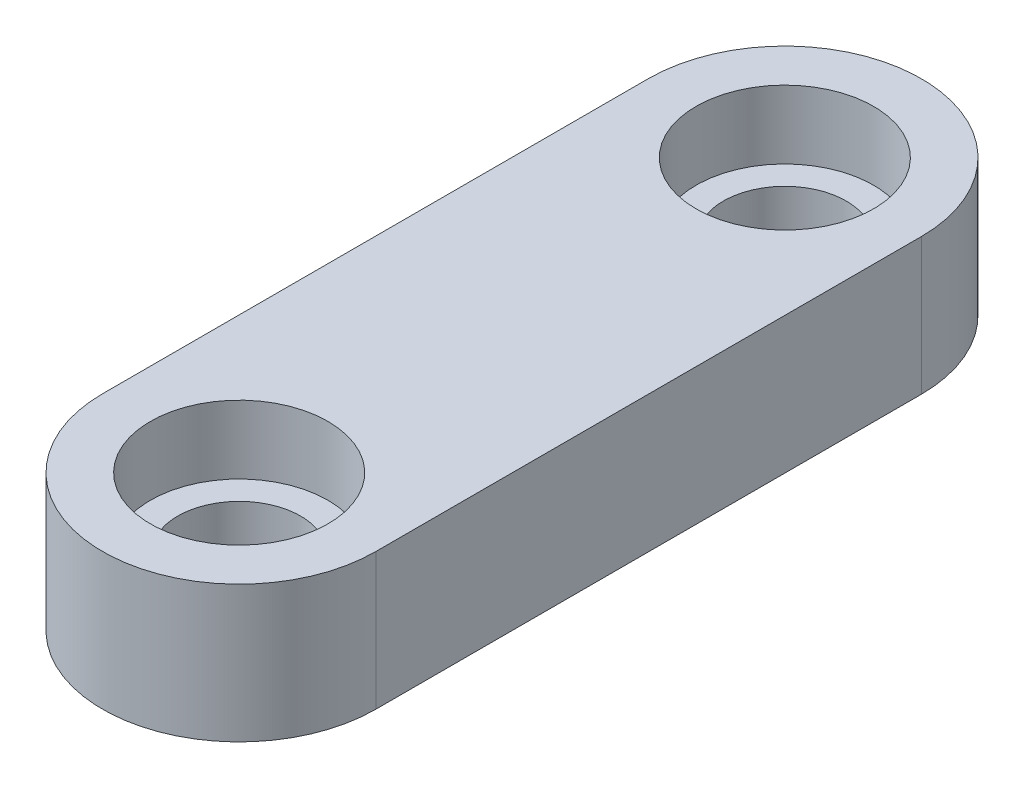
from build123d import *

# Parameters (mm, degrees)
SKETCH_1_W          = 20
SKETCH_1_H          = 10
EXTRUDE_1_DEPTH     = 59.939609738
SKETCH_2_R          = 6.5
CUT_EXTRUDE_1_DEPTH = 5
SKETCH_3_R          = 4.5
CUT_EXTRUDE_2_DEPTH = 20
CUT_EXTRUDE_3_DEPTH = 10
EXTRUDE_2_DEPTH     = 5
SKETCH_5_W          = 3.108428341
SKETCH_5_H          = 8
CUT_EXTRUDE_4_DEPTH = 8
SKETCH_7_R          = 1.25
CUT_EXTRUDE_5_DEPTH = 8


with BuildPart() as part:
    # 스케치1 → 보스-돌출1 (new body)
    with BuildSketch(Plane.XY):
        Rectangle(SKETCH_1_W, SKETCH_1_H)
    extrude(amount=EXTRUDE_1_DEPTH)

    # 스케치2 → 컷-돌출1 (cut)
    with BuildSketch(Plane(origin=(0, 5, 0), x_dir=(1, 0, 0), z_dir=(0, 1, 0))):
        with Locations((0, -10)):
            Circle(SKETCH_2_R)
    cut_extrude_1 = extrude(amount=-CUT_EXTRUDE_1_DEPTH, mode=Mode.SUBTRACT)

    # 스케치3 → 컷-돌출2 (cut)
    with BuildSketch(Plane(origin=(0, 5, 0), x_dir=(1, 0, 0), z_dir=(0, 1, 0))):
        with Locations((0, -10)):
            Circle(SKETCH_3_R)
    cut_extrude_2 = extrude(amount=-CUT_EXTRUDE_2_DEPTH, mode=Mode.SUBTRACT)

    # 스케치3<4> → 컷-돌출3 (cut)
    with BuildSketch(Plane(origin=(0, 5, 0), x_dir=(1, 0, 0), z_dir=(0, 1, 0))):
        with BuildLine():
            Line((-10, 0), (-10, -10))
            ThreePointArc((-10, -10), (-7.071067806, -2.928932182), (1.6e-08, 0))
            Line((1.6e-08, 0), (-10, 0))
        make_face()
        with BuildLine():
            Line((10, 0), (1.6e-08, 0))
            ThreePointArc((1.6e-08, 0), (7.071067818, -2.928932194), (10, -10))
            Line((10, -10), (10, 0))
        make_face()
    cut_extrude_3 = extrude(amount=-CUT_EXTRUDE_3_DEPTH, mode=Mode.SUBTRACT)

    # 대칭 복사1: 컷-돌출1, 컷-돌출2, 컷-돌출3 across plane
    add(cut_extrude_1.mirror(Plane.XY.offset(29.969804869)), mode=Mode.SUBTRACT)
    add(cut_extrude_2.mirror(Plane.XY.offset(29.969804869)), mode=Mode.SUBTRACT)
    add(cut_extrude_3.mirror(Plane.XY.offset(29.969804869)), mode=Mode.SUBTRACT)

    # 스케치4 → 보스-돌출2 (add)
    with BuildSketch(Plane(origin=(0, -5, 0), x_dir=(1, 0, 0), z_dir=(0, 1, 0))):
        Polygon((-3.744634418, -37.385339203), (-10, -33.773802201), (-10, -29.747626971), (0, -29.747626971), (0, -33.840387137), (-3.744634418, -33.840387137), align=None)
    extrude(amount=-EXTRUDE_2_DEPTH)

    # 스케치5 → 컷-돌출4 (cut)
    with BuildSketch(Plane.XZ.offset(5)):
        with Locations((-5.44578583, 25.747626971)):
            Rectangle(SKETCH_5_W, SKETCH_5_H)
    extrude(amount=-CUT_EXTRUDE_4_DEPTH, mode=Mode.SUBTRACT)

    # 스케치7 → 컷-돌출5 (cut)
    with BuildSketch(Plane(origin=(-7, 0, 0), x_dir=(0, 0, -1), z_dir=(1, 0, 0))):
        with Locations((-23.689322855, -1)):
            Circle(SKETCH_7_R)
        with Locations((-27.805931086, -1)):
            Circle(SKETCH_7_R)
    extrude(amount=-CUT_EXTRUDE_5_DEPTH, mode=Mode.SUBTRACT)


solid = part.part
